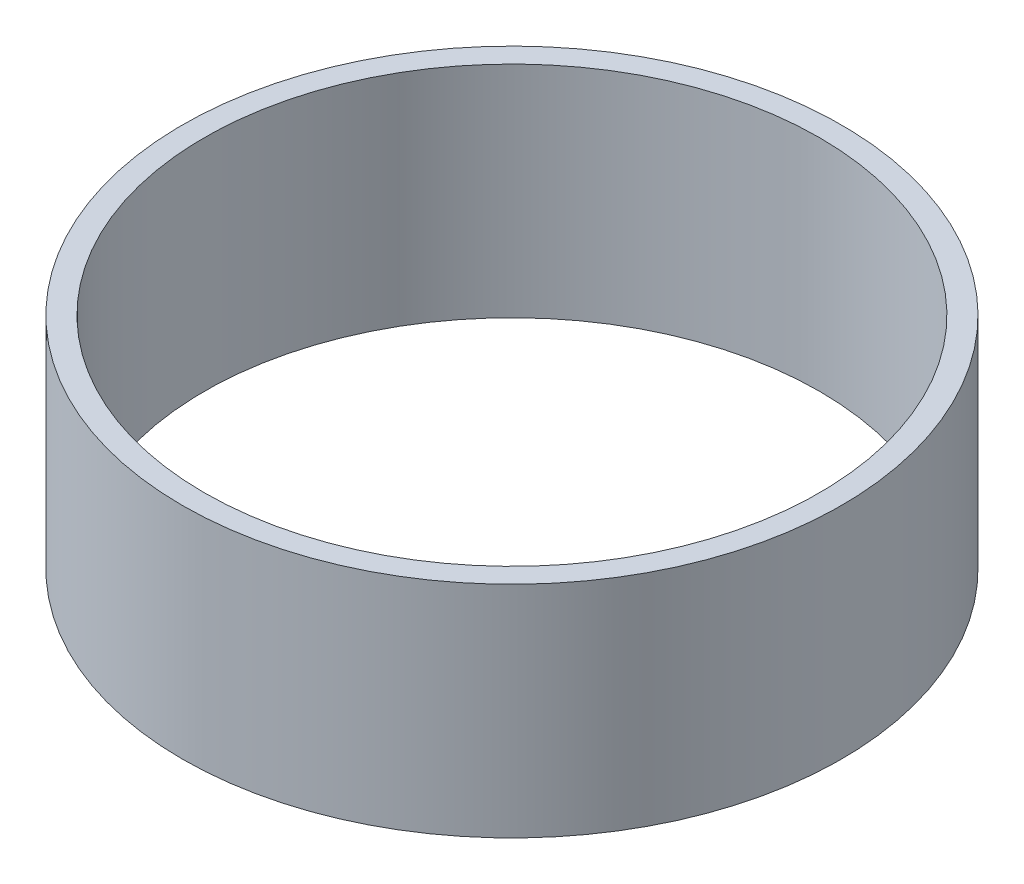
from build123d import *

# Parameters (mm, degrees)
SKETCH_1_R      = 75
SKETCH_1_R_2    = 70
EXTRUDE_1_DEPTH = 25


with BuildPart() as part:
    # 草图1 → 凸台-拉伸1 (new, symmetric)
    with BuildSketch(Plane(origin=(0, 0, 0), x_dir=(1, 0, 0), z_dir=(0, 1, 0))):
        with Locations(Location((0, 0, 0), (0, 0, 270))):
            Circle(SKETCH_1_R)
        with Locations(Location((0, 0, 0), (0, 0, 270))):
            Circle(SKETCH_1_R_2, mode=Mode.SUBTRACT)
    extrude(amount=EXTRUDE_1_DEPTH, both=True)


solid = part.part
